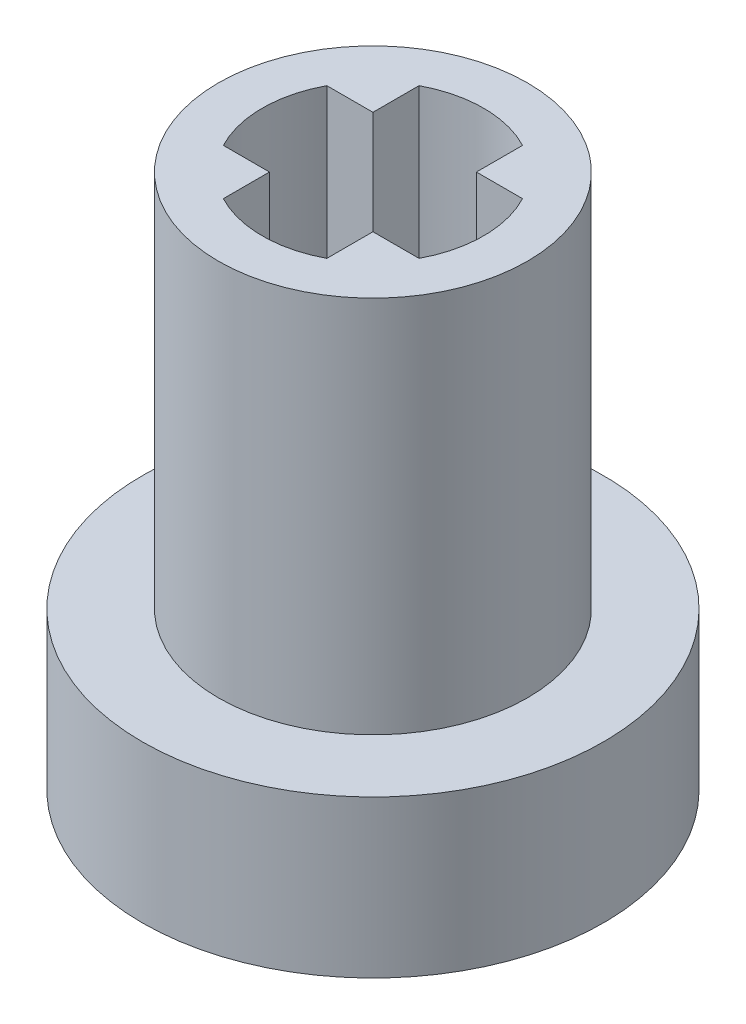
from build123d import *

# Parameters (mm, degrees)
SKETCH_1_R          = 5
EXTRUDE_1_DEPTH     = 3.4
SKETCH_1_3_R        = 2.55
CUT_EXTRUDE_1_DEPTH = 2.4
SKETCH_2_R          = 3.35
EXTRUDE_2_DEPTH     = 0.2
EXTRUDE_START       = 0.2
SKETCH_2_3_R        = 3.35
SKETCH_2_3_R_2      = 2.4
EXTRUDE_3_DEPTH     = 8


with BuildPart() as part:
    # 草图1 → 凸台-拉伸1 (new body)
    with BuildSketch(Plane(origin=(0, 0, 0), x_dir=(1, 0, 0), z_dir=(0, 1, 0))):
        with Locations(Location((0, 0, 0), (0, 0, 270))):
            Circle(SKETCH_1_R)
    extrude(amount=EXTRUDE_1_DEPTH)

    # 草图1<3> → 切除-拉伸1 (cut)
    with BuildSketch(Plane(origin=(0, 0, 0), x_dir=(1, 0, 0), z_dir=(0, 1, 0))):
        with Locations(Location((0, 0, 0), (0, 0, 270))):
            Circle(SKETCH_1_3_R)
    extrude(amount=CUT_EXTRUDE_1_DEPTH, mode=Mode.SUBTRACT)

    # 草图2 → 凸台-拉伸2 (add)
    with BuildSketch(Plane(origin=(0, 3.4, 0), x_dir=(1, 0, 0), z_dir=(0, 1, 0))):
        with Locations(Location((0, 0, 0), (0, 0, 270))):
            Circle(SKETCH_2_R)
    extrude(amount=EXTRUDE_2_DEPTH)

    # 草图2<3> → 凸台-拉伸3 (add)
    # profile 1 of 5: a face of its own
    with BuildSketch(Plane(origin=(0, 3.4, 0), x_dir=(1, 0, 0), z_dir=(0, 1, 0)).offset(EXTRUDE_START)):
        with Locations(Location((0, 0, 0), (0, 0, 270))):
            Circle(SKETCH_2_3_R)
        Circle(SKETCH_2_3_R_2, mode=Mode.SUBTRACT)
    # profile 2 of 5: a face of its own
    with BuildSketch(Plane(origin=(0, 3.4, 0), x_dir=(1, 0, 0), z_dir=(0, 1, 0)).offset(EXTRUDE_START)):
        with BuildLine():
            Line((-1.121727474, 1.121727474), (-1.121727474, 2.121727474))
            ThreePointArc((-1.121727474, 2.121727474), (-1.697056275, 1.697056275), (-2.121727474, 1.121727474))
            Line((-2.121727474, 1.121727474), (-1.121727474, 1.121727474))
        make_face()
    # profile 3 of 5: a face of its own
    with BuildSketch(Plane(origin=(0, 3.4, 0), x_dir=(1, 0, 0), z_dir=(0, 1, 0)).offset(EXTRUDE_START)):
        with BuildLine():
            ThreePointArc((2.121727474, 1.121727474), (1.697056275, 1.697056275), (1.121727474, 2.121727474))
            Line((1.121727474, 2.121727474), (1.121727474, 1.121727474))
            Line((1.121727474, 1.121727474), (2.121727474, 1.121727474))
        make_face()
    # profile 4 of 5: a face of its own
    with BuildSketch(Plane(origin=(0, 3.4, 0), x_dir=(1, 0, 0), z_dir=(0, 1, 0)).offset(EXTRUDE_START)):
        with BuildLine():
            Line((-1.121727474, -2.121727474), (-1.121727474, -1.121727474))
            Line((-1.121727474, -1.121727474), (-2.121727474, -1.121727474))
            ThreePointArc((-2.121727474, -1.121727474), (-1.697056275, -1.697056275), (-1.121727474, -2.121727474))
        make_face()
    # profile 5 of 5: a face of its own
    with BuildSketch(Plane(origin=(0, 3.4, 0), x_dir=(1, 0, 0), z_dir=(0, 1, 0)).offset(EXTRUDE_START)):
        with BuildLine():
            Line((2.121727474, -1.121727474), (1.121727474, -1.121727474))
            Line((1.121727474, -1.121727474), (1.121727474, -2.121727474))
            ThreePointArc((1.121727474, -2.121727474), (1.697056275, -1.697056275), (2.121727474, -1.121727474))
        make_face()
    extrude(amount=EXTRUDE_3_DEPTH)


solid = part.part
